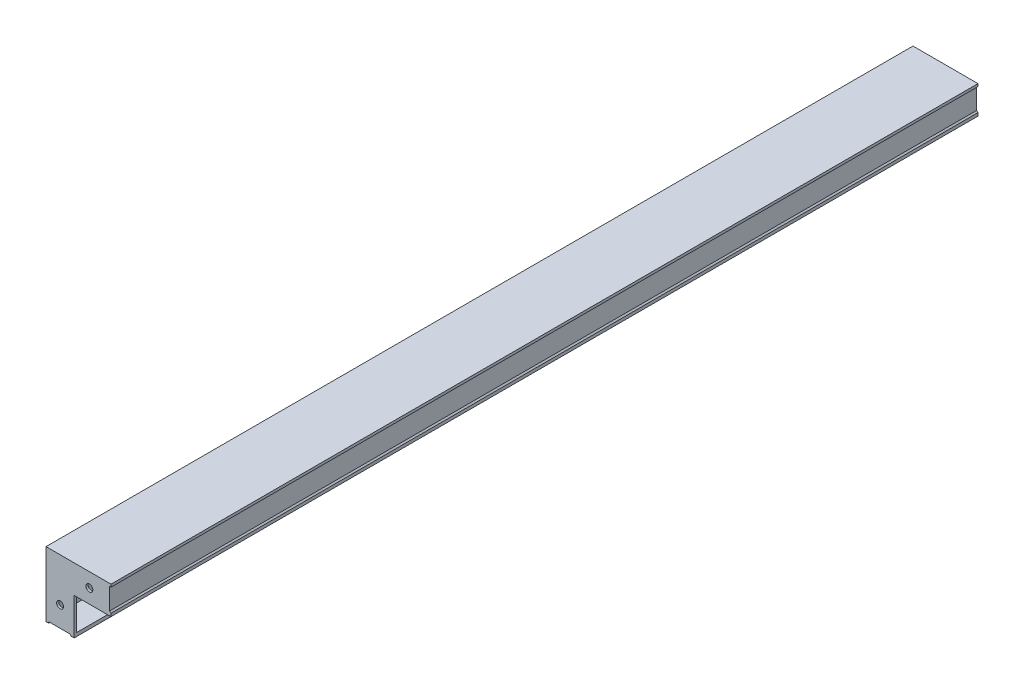
from build123d import *

# Parameters (mm, degrees)
EXTRUDE_1_DEPTH         = 2000
EXTRUDE_2_DEPTH         = 5
HOLE_WIZARD_16_0_16_1_D = 16


with BuildPart() as part:
    # Model → 凸台-拉伸1 (new body)
    with BuildSketch(Plane.XY):
        with BuildLine():
            Line((55, -147), (6, -147))
            Line((6, -147), (6, -150))
            Line((6, -150), (0, -150))
            Line((0, -150), (0, 0))
            Line((0, 0), (150, 0))
            Line((150, 0), (150, -6))
            Line((150, -6), (147, -6))
            Line((147, -6), (147, -55))
            Line((147, -55), (150, -58))
            Line((150, -58), (150, -65))
            Line((150, -65), (142, -65))
            Line((142, -65), (142, -6))
            Line((142, -6), (9, -6))
            ThreePointArc((9, -6), (6.878679656, -6.878679656), (6, -9))
            Line((6, -9), (6, -142))
            Line((6, -142), (65, -142))
            Line((65, -142), (65, -150))
            Line((65, -150), (58, -150))
            Line((58, -150), (55, -147))
        make_face()
    extrude(amount=EXTRUDE_1_DEPTH)

    # 草图2 → 凸台-拉伸2 (add)
    with BuildSketch(Plane.XY.offset(2000)):
        Polygon((65, -142), (65, -65), (142, -65), (142, -6), (6, -6), (6, -142), align=None)
    extrude_2 = extrude(amount=-EXTRUDE_2_DEPTH)

    # 镜向1: 凸台-拉伸2 across plane
    add(extrude_2.mirror(Plane.XY.offset(1000)))

    # Ø16.0 (16) 直径孔1 (through all)
    with Locations(Plane.XY.offset(2000)):
        with Locations((100, -32.5), (32.5, -100)):
            Hole(HOLE_WIZARD_16_0_16_1_D / 2)


solid = part.part
